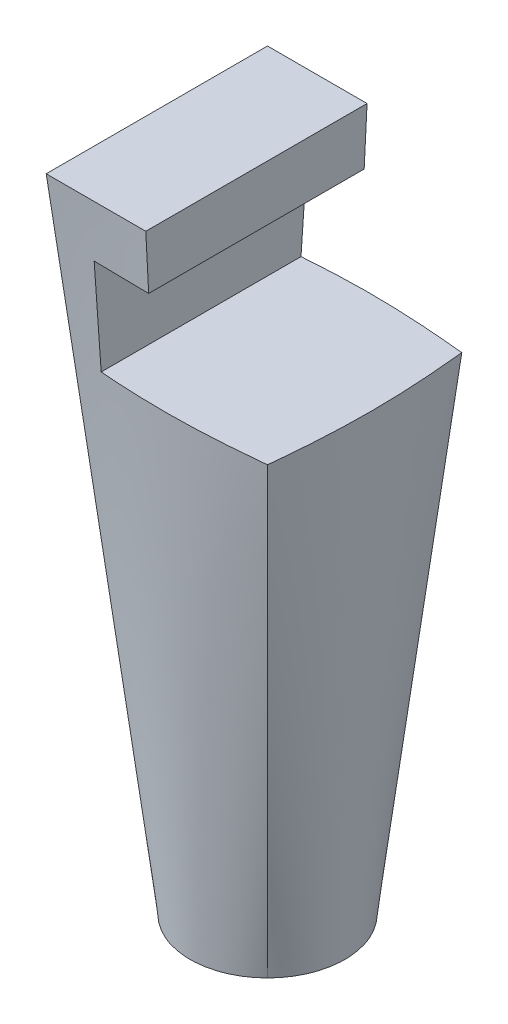
from build123d import *

# Parameters (mm, degrees)
CUT_EXTRUDE3_DEPTH      = 10
CUT_EXTRUDE3_DEPTH_BACK = 10
SKETCH3_R               = 1
CUT_EXTRUDE2_DEPTH      = 8
CHAMFER1_SIZE           = 1


with BuildPart() as part:
    # Sketch4 for Loft1 → Loft1 section 0
    with BuildSketch(Plane(origin=(0, 0, 0), x_dir=(1, 0, 0), z_dir=(0, 1, 0))):
        with BuildLine():
            # circular arc as an exact rational Bezier (weights 1, cos(half-angle), 1)
            Bezier((-1.237436867, -1.237436867), (0, -2.474873734), (1.237436867, -1.237436867), weights=[1, 0.707106781, 1])
            Bezier((1.237436867, -1.237436867), (2.474873734, 0), (1.237436867, 1.237436867), weights=[1, 0.707106781, 1])
            Bezier((1.237436867, 1.237436867), (0, 2.474873734), (-1.237436867, 1.237436867), weights=[1, 0.707106781, 1])
            Bezier((-1.237436867, 1.237436867), (-2.474873734, 0), (-1.237436867, -1.237436867), weights=[1, 0.707106781, 1])
        make_face()
    # Sketch1 → Loft1 section 1
    with BuildSketch(Plane(origin=(0, 14.5, 0), x_dir=(1, 0, 0), z_dir=(0, 1, 0))):
        with BuildLine():
            Line((-2.5, -2.5), (2.5, -2.5))
            Line((2.5, -2.5), (2.5, 2.5))
            Line((2.5, 2.5), (-2.5, 2.5))
            Line((-2.5, 2.5), (-2.5, -2.5))
        make_face()
    loft()

    # Sketch8 → Cut-Extrude3 (cut, two sides: drawn at the far end of the back side and taken through both)
    with BuildSketch(Plane.XY.offset(-CUT_EXTRUDE3_DEPTH_BACK)):
        Polygon((-0.25, 13.25), (-1.5, 13.25), (-1.5, 11), (2.195243382, 11), (3.151773284, 11), (3.151773284, 14.772897757), (-0.25, 14.772897757), align=None)
    extrude(amount=CUT_EXTRUDE3_DEPTH + CUT_EXTRUDE3_DEPTH_BACK, mode=Mode.SUBTRACT)

    # Sketch3 → Cut-Extrude2 (cut)
    with BuildSketch(Plane.XZ):
        Circle(SKETCH3_R)
    extrude(amount=-CUT_EXTRUDE2_DEPTH, mode=Mode.SUBTRACT)

    # Chamfer1
    chamfer1_edges = [part.edges().sort_by_distance(p)[0] for p in [
        (-1, 8, 0),
    ]]
    chamfer(chamfer1_edges, length=CHAMFER1_SIZE)


solid = part.part
